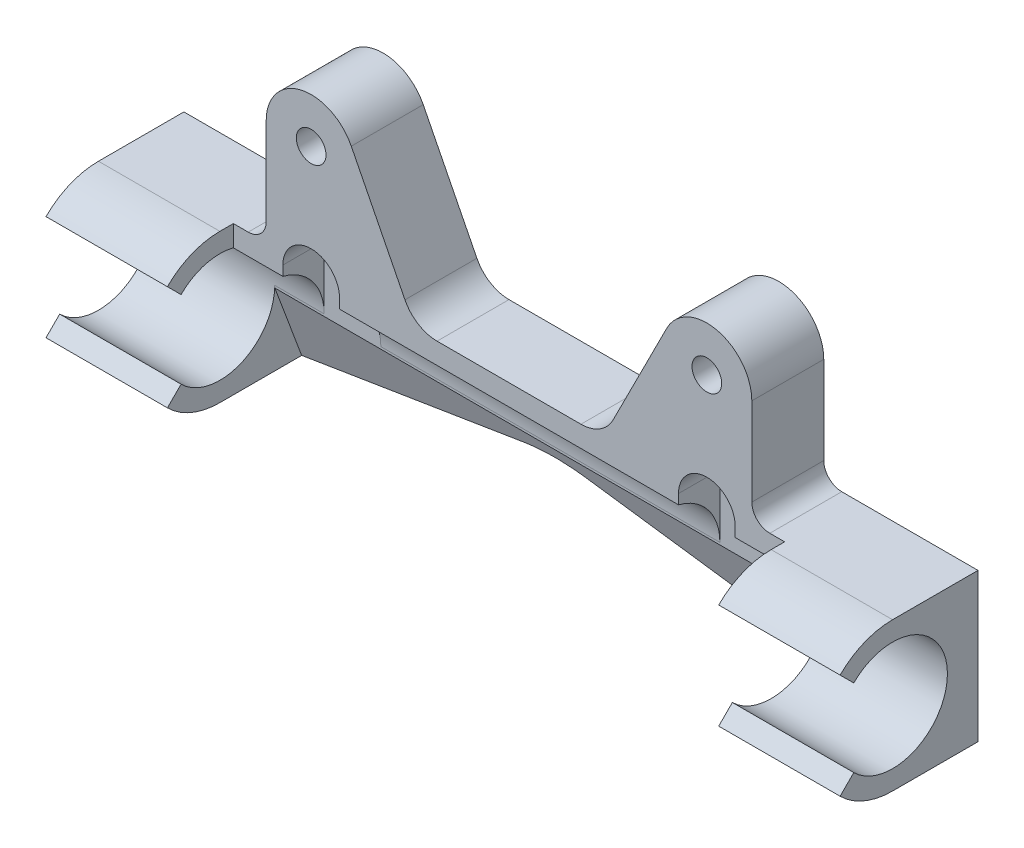
from build123d import *

# Parameters (mm, degrees)
BOSS_EXTRUDE1_DEPTH = 88.3
SKETCH6_R           = 1.65
BOSS_EXTRUDE2_DEPTH = 8
CUT_EXTRUDE1_DEPTH  = 93.261259475
SKETCH8_W           = 61.3
SKETCH8_H           = 21.483950942
CUT_EXTRUDE2_DEPTH  = 93.118890571
SKETCH9_W           = 61.3
SKETCH9_H           = 11.699409457
CUT_EXTRUDE3_DEPTH  = 93.543511645
SKETCH10_R          = 1.65
CUT_EXTRUDE4_DEPTH  = 94.043055829
CHAMFER1_SIZE       = 8
CHAMFER1_SIZE2      = 3
CUT_EXTRUDE5_DEPTH  = 93.54351174
FILLET1_R           = 2
CUT_EXTRUDE6_DEPTH  = 3
CUT_EXTRUDE7_START  = -4.6
CUT_EXTRUDE7_DEPTH  = 4.6


with BuildPart() as part:
    # Sketch1 → Boss-Extrude1 (new body)
    with BuildSketch(Plane.ZY):
        with BuildLine():
            Line((-9.5, 8.25), (-9.5, -8.25))
            Line((-9.5, -8.25), (0, -8.25))
            ThreePointArc((0, -8.25), (8.25, 0), (0, 8.25))
            Line((0, 8.25), (-9.5, 8.25))
        make_face()
    extrude(amount=BOSS_EXTRUDE1_DEPTH)

    # Sketch6 → Boss-Extrude2 (add)
    with BuildSketch(Plane(origin=(0, 0, -9.5), x_dir=(-1, 0, 0), z_dir=(0, 0, -1))):
        with BuildLine():
            Line((17.15, -8.25), (17.15, 20))
            ThreePointArc((17.15, 20), (20.99096395, 24.863808737), (26.612654174, 22.254931867))
            Line((26.612654174, 22.254931867), (32.579554775, 10.446054507))
            ThreePointArc((32.579554775, 10.446054507), (34.053942202, 8.842964487), (36.149678114, 8.25))
            Line((36.149678114, 8.25), (52.150321886, 8.25))
            ThreePointArc((52.150321886, 8.25), (54.246057798, 8.842964487), (55.720445225, 10.446054507))
            Line((55.720445225, 10.446054507), (61.687345826, 22.254931867))
            ThreePointArc((61.687345826, 22.254931867), (67.30903605, 24.863808737), (71.15, 20))
            Line((71.15, 20), (71.15, -8.25))
            Line((71.15, -8.25), (17.15, -8.25))
        make_face()
        with Locations((22.15, 20)):
            Circle(SKETCH6_R, mode=Mode.SUBTRACT)
        with Locations(Location((66.15, 20, 0), (0, 0, 180))):
            Circle(SKETCH6_R, mode=Mode.SUBTRACT)
    extrude(amount=-BOSS_EXTRUDE2_DEPTH)

    # Sketch7 → Cut-Extrude1 (cut, through all)
    with BuildSketch(Plane.ZY.offset(88.3)):
        with BuildLine():
            Line((13.481907846, 13.481907846), (4.313351365, 4.313351365))
            ThreePointArc((4.313351365, 4.313351365), (-6.1, 0), (4.313351365, -4.313351365))
            Line((4.313351365, -4.313351365), (13.481907846, -13.481907846))
            Line((13.481907846, -13.481907846), (13.481907846, 13.481907846))
        make_face()
    extrude(amount=-CUT_EXTRUDE1_DEPTH, mode=Mode.SUBTRACT)

    # Sketch8 → Cut-Extrude2 (cut, through all)
    with BuildSketch(Plane.XY.offset(-1.5)):
        with Locations((-44.15, -2.491975471)):
            Rectangle(SKETCH8_W, SKETCH8_H)
    extrude(amount=CUT_EXTRUDE2_DEPTH, mode=Mode.SUBTRACT)

    # Sketch9 → Cut-Extrude3 (cut, through all)
    with BuildSketch(Plane(origin=(0, 0, -6.1), x_dir=(-1, 0, 0), z_dir=(0, 0, -1))):
        with Locations((44.15, -5.849704729)):
            Rectangle(SKETCH9_W, SKETCH9_H)
    extrude(amount=-CUT_EXTRUDE3_DEPTH, mode=Mode.SUBTRACT)

    # Sketch10 → Cut-Extrude4 (cut, through all)
    with BuildSketch(Plane(origin=(0, 0, -9.5), x_dir=(-1, 0, 0), z_dir=(0, 0, -1))):
        with Locations((22.15, 7)):
            Circle(SKETCH10_R)
        with Locations((66.15, 7)):
            Circle(SKETCH10_R)
    extrude(amount=-CUT_EXTRUDE4_DEPTH, mode=Mode.SUBTRACT)

    # Chamfer1
    chamfer1_edges = [part.edges().sort_by_distance(p)[0] for p in [
        (-44.15, -8.25, -6.1),
    ]]
    chamfer1_side = [part.faces().sort_by_distance(p)[0] for p in [
        (-44.15, -4.125, -6.1),
    ]]
    chamfer(chamfer1_edges, length=CHAMFER1_SIZE, length2=CHAMFER1_SIZE2, reference=chamfer1_side[0])

    # Sketch11 → Cut-Extrude5 (cut, through all)
    with BuildSketch(Plane(origin=(0, 0, -6.1), x_dir=(-1, 0, 0), z_dir=(0, 0, -1))):
        with BuildLine():
            Line((74.8, -8.25), (47.5958626, -1.828822614))
            ThreePointArc((47.5958626, -1.828822614), (44.15, -1.427659244), (40.7041374, -1.828822614))
            Line((40.7041374, -1.828822614), (13.5, -8.25))
            Line((13.5, -8.25), (13.5, -16.427659244))
            Line((13.5, -16.427659244), (74.8, -16.427659244))
            Line((74.8, -16.427659244), (74.8, -8.25))
        make_face()
    extrude(amount=CUT_EXTRUDE5_DEPTH, mode=Mode.SUBTRACT)

    # Fillet1
    fillet1_edges = [part.edges().sort_by_distance(p)[0] for p in [
        (-17.15, 8.25, -5.5),
        (-71.15, 8.25, -5.5),
    ]]
    fillet(fillet1_edges, radius=FILLET1_R)

    # Sketch12 → Cut-Extrude6 (cut)
    with BuildSketch(Plane(origin=(0, 0, -9.5), x_dir=(-1, 0, 0), z_dir=(0, 0, -1))):
        Polygon((22.15, 16.651368439), (25.05, 18.325684219), (25.05, 21.674315781), (22.15, 23.348631561), (19.25, 21.674315781), (19.25, 18.325684219), align=None)
        Polygon((66.15, 16.651368439), (69.05, 18.325684219), (69.05, 21.674315781), (66.15, 23.348631561), (63.25, 21.674315781), (63.25, 18.325684219), align=None)
    extrude(amount=-CUT_EXTRUDE6_DEPTH, mode=Mode.SUBTRACT)

    # Sketch13 → Cut-Extrude7 (cut)
    with BuildSketch(Plane.XY.offset(-1.5).offset(CUT_EXTRUDE7_START)):
        with BuildLine():
            Line((-69.3, 7), (-69.3, -2.12397244))
            Line((-69.3, -2.12397244), (-63, -2.12397244))
            Line((-63, -2.12397244), (-63, 7))
            ThreePointArc((-63, 7), (-66.15, 10.15), (-69.3, 7))
        make_face()
        with BuildLine():
            Line((-25.3, 7), (-25.3, -2.12397244))
            Line((-25.3, -2.12397244), (-19, -2.12397244))
            Line((-19, -2.12397244), (-19, 7))
            ThreePointArc((-19, 7), (-22.15, 10.15), (-25.3, 7))
        make_face()
    extrude(amount=CUT_EXTRUDE7_DEPTH, mode=Mode.SUBTRACT)


solid = part.part
